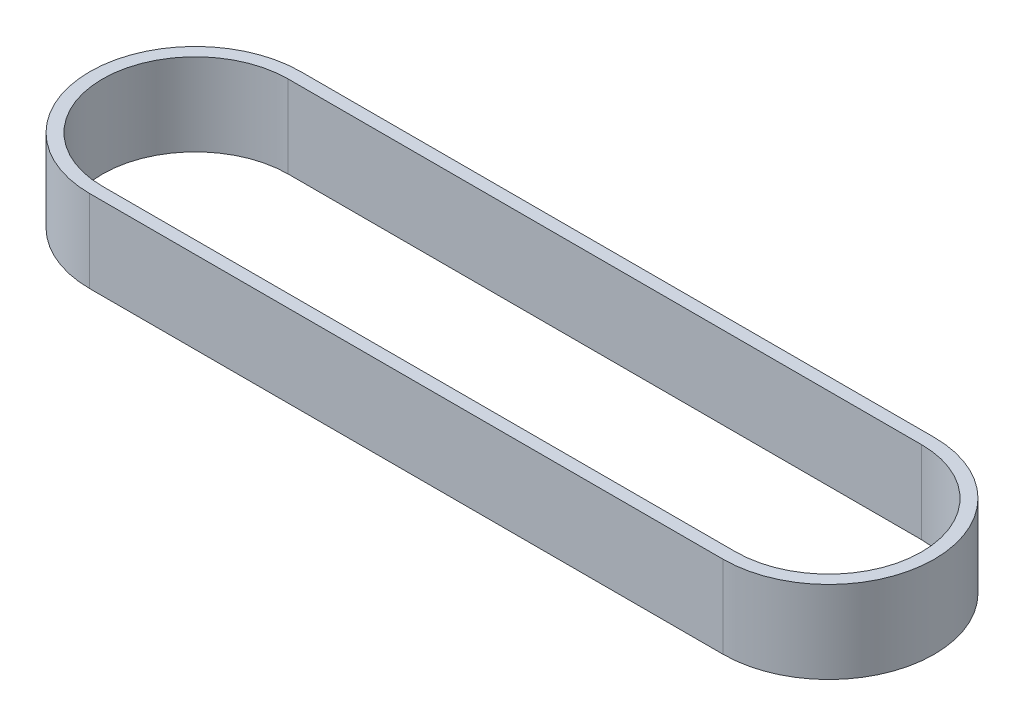
from build123d import *

# Parameters (mm, degrees)
BOSS_EXTRUDE1_DEPTH = 39


with BuildPart() as part:
    # Sketch1 → Boss-Extrude1 (new body)
    with BuildSketch(Plane(origin=(0, 0, 0), x_dir=(1, 0, 0), z_dir=(0, 1, 0))):
        with BuildLine():
            Line((-150, 50), (150, 50))
            ThreePointArc((150, 50), (200, 0), (150, -50))
            Line((150, -50), (-150, -50))
            ThreePointArc((-150, -50), (-200, 0), (-150, 50))
        make_face()
        with BuildLine():
            Line((-150, 44), (150, 44))
            ThreePointArc((150, 44), (194, 0), (150, -44))
            Line((150, -44), (-150, -44))
            ThreePointArc((-150, -44), (-194, 0), (-150, 44))
        make_face(mode=Mode.SUBTRACT)
    extrude(amount=BOSS_EXTRUDE1_DEPTH)


solid = part.part
